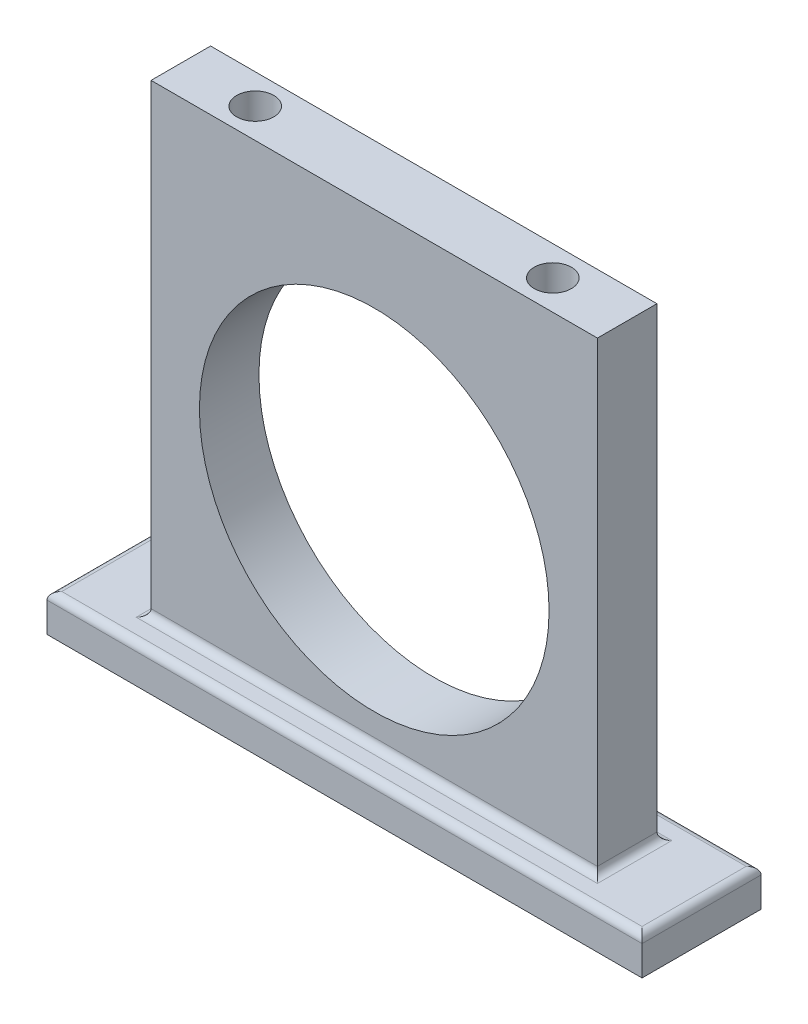
from build123d import *

# Parameters (mm, degrees)
SKETCH_1_R             = 23.5
EXTRUDE_1_DEPTH        = 8
SKETCH_2_W             = 16
SKETCH_2_H             = 5
EXTRUDE_2_DEPTH        = 70
FILLET_2_R             = 1
HOLE_WIZARD_M6_1_D     = 5
HOLE_WIZARD_M6_1_DEPTH = 7
HOLE_WIZARD_M6_1_TIP   = 1.502151548


with BuildPart() as part:
    # 草图1 → 凸台-拉伸1 (new body)
    with BuildSketch(Plane.XY):
        Polygon((30, -32.5), (-30, -32.5), (-30, 0), (-30, 35), (30, 35), align=None)
        Circle(SKETCH_1_R, mode=Mode.SUBTRACT)
    extrude(amount=EXTRUDE_1_DEPTH)

    # 草图2 → 凸台-拉伸2 (add)
    with BuildSketch(Plane(origin=(30, 0, 0), x_dir=(0, 0, -1), z_dir=(1, 0, 0))):
        with Locations((-4, -30)):
            Rectangle(SKETCH_2_W, SKETCH_2_H)
    extrude_2 = extrude(amount=-EXTRUDE_2_DEPTH)

    # 镜向1: 凸台-拉伸2 across plane
    add(extrude_2.mirror(Plane.ZY))

    # 圆角2
    fillet_2_edges = [part.edges().sort_by_distance(p)[0] for p in [
        (0, -27.5, 0),
        (-40, -27.5, 4),
        (0, -27.5, 12),
        (-30, -27.5, 4),
        (0, -27.5, 8),
        (0, -27.5, -4),
        (30, -27.5, 4),
        (40, -27.5, 4),
    ]]
    fillet(fillet_2_edges, radius=FILLET_2_R)

    # M6 螺纹孔1
    with Locations(Plane(origin=(0, 35, 0), x_dir=(1, 0, 0), z_dir=(0, 1, 0))):
        with Locations((-20, -4), (20, -4)):
            Hole(HOLE_WIZARD_M6_1_D / 2, depth=HOLE_WIZARD_M6_1_DEPTH)
            with Locations((0, 0, -(HOLE_WIZARD_M6_1_DEPTH + HOLE_WIZARD_M6_1_TIP / 2))):  # 118° drill point
                Cone(0, HOLE_WIZARD_M6_1_D / 2, HOLE_WIZARD_M6_1_TIP, mode=Mode.SUBTRACT)


solid = part.part
